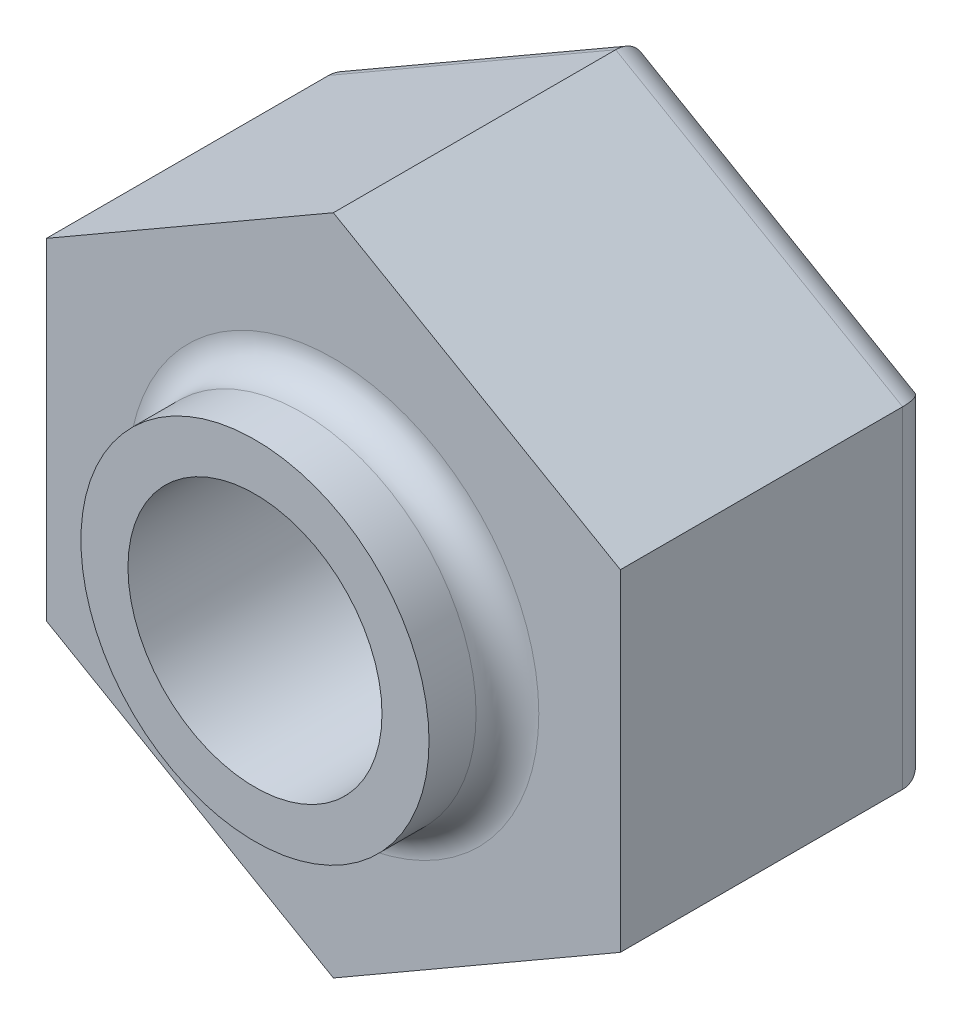
from build123d import *

# Parameters (mm, degrees)
SKETCH1_R           = 4.05
BOSS_EXTRUDE1_DEPTH = 10
SKETCH2_R           = 5.55
SKETCH2_R_2         = 4.05
BOSS_EXTRUDE2_DEPTH = 2.5
FILLET1_R           = 1


with BuildPart() as part:
    # Sketch1 → Boss-Extrude1 (new body)
    with BuildSketch(Plane.XY):
        Polygon((9.15, -5.282754963), (9.15, 5.282754963), (0, 10.565509926), (-9.15, 5.282754963), (-9.15, -5.282754963), (0, -10.565509926), align=None)
        Circle(SKETCH1_R, mode=Mode.SUBTRACT)
    extrude(amount=BOSS_EXTRUDE1_DEPTH)

    # Sketch2 → Boss-Extrude2 (add)
    with BuildSketch(Plane.XY.offset(10)):
        Circle(SKETCH2_R)
        Circle(SKETCH2_R_2, mode=Mode.SUBTRACT)
    extrude(amount=BOSS_EXTRUDE2_DEPTH)

    # Fillet1
    fillet1_edges = [part.edges().sort_by_distance(p)[0] for p in [
        (-4.05, 0, 0),
        (-5.55, 0, 10),
        (-4.575, -7.924132445, 0),
        (-9.15, 0, 0),
        (-4.575, 7.924132445, 0),
        (4.575, 7.924132445, 0),
        (9.15, 0, 0),
        (4.575, -7.924132445, 0),
    ]]
    fillet(fillet1_edges, radius=FILLET1_R)


solid = part.part
